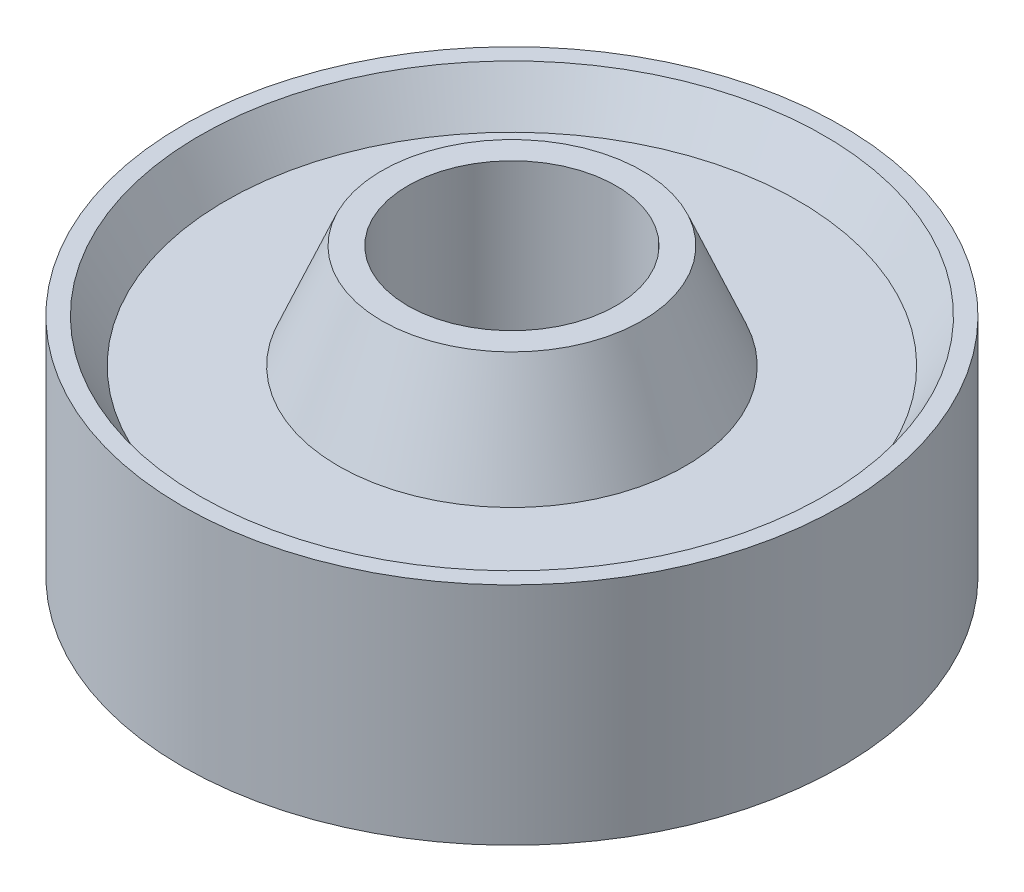
from build123d import *

# Parameters (mm, degrees)
SKETCH2_R          = 12
CUT_EXTRUDE1_DEPTH = 67.992536898


with BuildPart() as part:
    # Sketch1 → Revolve1 (revolve)
    with BuildSketch(Plane.XY, mode=Mode.PRIVATE) as revolve1_sk:
        Polygon((0, 20), (15, 20), (20, 8), (33, 8), (36, 13), (38, 13), (38, -13), (36, -13), (33, -8), (20, -8), (15, -20), (0, -20), align=None)
    revolve(revolve1_sk.sketch.rotate(Axis((0, 20, 0), (0, -1, 0)), 90), axis=Axis((0, 20, 0), (0, -1, 0)))

    # Sketch2 → Cut-Extrude1 (cut, through all)
    with BuildSketch(Plane(origin=(0, 20, 0), x_dir=(1, 0, 0), z_dir=(0, 1, 0))):
        with Locations(Location((0, 0, 0), (0, 0, 270))):
            Circle(SKETCH2_R)
    extrude(amount=-CUT_EXTRUDE1_DEPTH, mode=Mode.SUBTRACT)


solid = part.part
